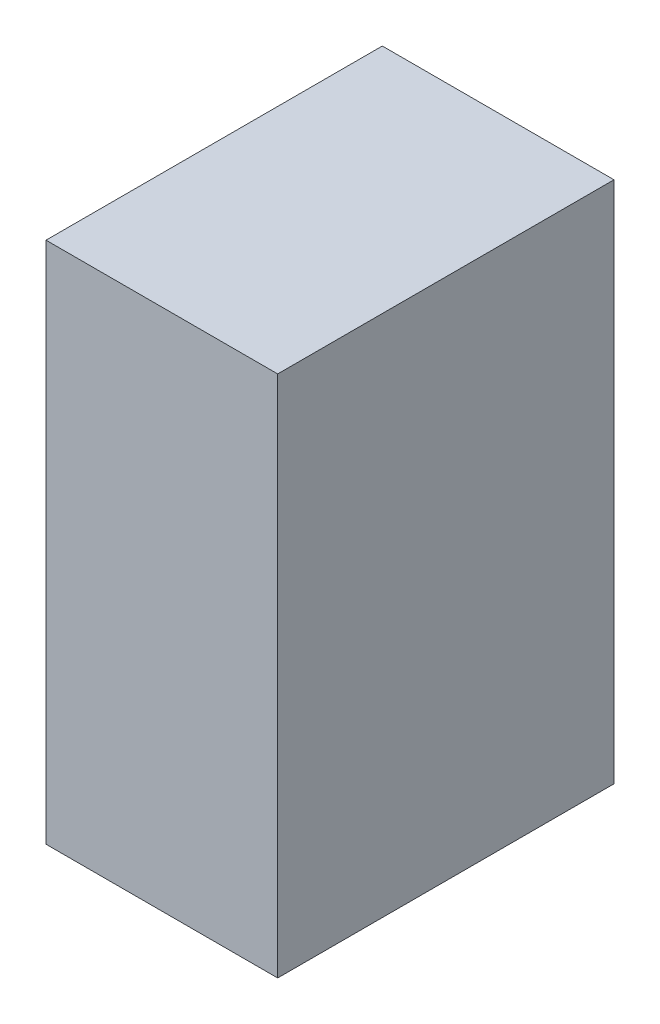
from build123d import *

# Parameters (mm, degrees)
BOSS_EXTRUDE1_DEPTH      = 44.45
BOSS_EXTRUDE1_DEPTH_BACK = 44.45
SKETCH1_W                = 39.37
SKETCH1_H                = 57.15


with BuildPart() as part:
    # Sketch1 → Boss-Extrude1 (new, two sides: drawn at the far end of the back side and taken through both)
    with BuildSketch(Plane(origin=(0, 0, 0), x_dir=(1, 0, 0), z_dir=(0, 1, 0)).offset(-BOSS_EXTRUDE1_DEPTH_BACK)):
        Rectangle(SKETCH1_W, SKETCH1_H)
    extrude(amount=BOSS_EXTRUDE1_DEPTH + BOSS_EXTRUDE1_DEPTH_BACK)


solid = part.part
